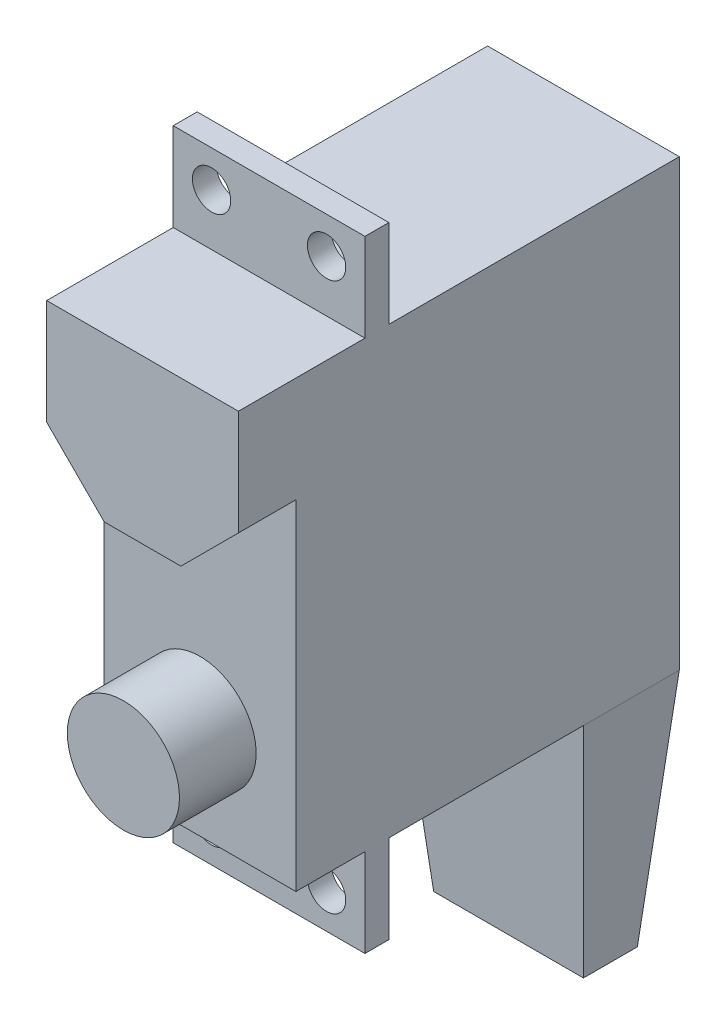
from build123d import *

# Parameters (mm, degrees)
SKETCH1_W           = 23.2
SKETCH1_H           = 10
BOSS_EXTRUDE1_DEPTH = 20
SKETCH2_W           = 10
SKETCH2_H           = 8.5
BOSS_EXTRUDE2_DEPTH = 3
CHAMFER1_SIZE       = 3
SKETCH3_R           = 2.925
BOSS_EXTRUDE3_DEPTH = 4
BOSS_EXTRUDE4_START = -3.6
SKETCH5_W           = 10
SKETCH5_H           = 32.4
BOSS_EXTRUDE4_DEPTH = 1.25
SKETCH6_R           = 1
CUT_EXTRUDE1_DEPTH  = 1.25
SKETCH7_W           = 10
SKETCH7_H           = 5
BOSS_EXTRUDE5_DEPTH = 12.5
BOSS_EXTRUDE5_TAPER = 5


with BuildPart() as part:
    # Sketch1 → Boss-Extrude1 (new body)
    with BuildSketch(Plane(origin=(0, 0, 0), x_dir=(0, 1, 0), z_dir=(0, 0, 1))):
        with Locations((11.6, 5)):
            Rectangle(SKETCH1_W, SKETCH1_H)
    extrude(amount=BOSS_EXTRUDE1_DEPTH)

    # Sketch2 → Boss-Extrude2 (add)
    with BuildSketch(Plane.XY.offset(20)):
        with Locations((-5, 18.95)):
            Rectangle(SKETCH2_W, SKETCH2_H)
    extrude(amount=BOSS_EXTRUDE2_DEPTH)

    # Chamfer1
    chamfer1_edges = [part.edges().sort_by_distance(p)[0] for p in [
        (-10, 14.7, 21.5),
        (0, 14.7, 21.5),
    ]]
    chamfer(chamfer1_edges, length=CHAMFER1_SIZE)

    # Sketch3 → Boss-Extrude3 (add)
    with BuildSketch(Plane.XY.offset(20)):
        with Locations(Location((-5, 5.2, 0), (0, 0, 180))):
            Circle(SKETCH3_R)
    extrude(amount=BOSS_EXTRUDE3_DEPTH)

    # Sketch5 → Boss-Extrude4 (add)
    with BuildSketch(Plane.XY.offset(20).offset(BOSS_EXTRUDE4_START)):
        with Locations((-5, 11.6)):
            Rectangle(SKETCH5_W, SKETCH5_H)
    extrude(amount=-BOSS_EXTRUDE4_DEPTH)

    # Sketch6 → Cut-Extrude1 (cut)
    with BuildSketch(Plane.XY.offset(16.4)):
        with Locations((-8, -2.7)):
            Circle(SKETCH6_R)
        with Locations((-2, -2.7)):
            Circle(SKETCH6_R)
        with Locations((-8, 25.9)):
            Circle(SKETCH6_R)
        with Locations((-2, 25.9)):
            Circle(SKETCH6_R)
    extrude(amount=-CUT_EXTRUDE1_DEPTH, mode=Mode.SUBTRACT)

    # Sketch7 → Boss-Extrude5 (add)
    with BuildSketch(Plane.XZ):
        with Locations((-5, 2.5)):
            Rectangle(SKETCH7_W, SKETCH7_H)
    extrude(amount=BOSS_EXTRUDE5_DEPTH, taper=BOSS_EXTRUDE5_TAPER)


solid = part.part
